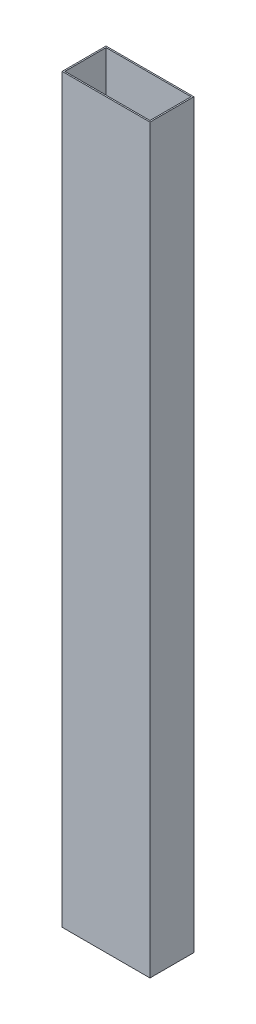
from build123d import *

# Parameters (mm, degrees)
SKETCH1_W           = 50.8
SKETCH1_H           = 25.4
BOSS_EXTRUDE1_DEPTH = 762
SKETCH2_W           = 49.1998
SKETCH2_H           = 23.7998
CUT_EXTRUDE1_DEPTH  = 763.528983056
SKETCH3_W           = 50.8
SKETCH3_H           = 25.4
CUT_EXTRUDE2_DEPTH  = 333.375


with BuildPart() as part:
    # Sketch1 → Boss-Extrude1 (new body)
    with BuildSketch(Plane(origin=(0, 0, 0), x_dir=(1, 0, 0), z_dir=(0, 1, 0))):
        Rectangle(SKETCH1_W, SKETCH1_H)
    extrude(amount=BOSS_EXTRUDE1_DEPTH)

    # Sketch2 → Cut-Extrude1 (cut, through all)
    with BuildSketch(Plane.XZ):
        Rectangle(SKETCH2_W, SKETCH2_H)
    extrude(amount=-CUT_EXTRUDE1_DEPTH, mode=Mode.SUBTRACT)

    # Sketch3 → Cut-Extrude2 (cut)
    with BuildSketch(Plane(origin=(0, 762, 0), x_dir=(1, 0, 0), z_dir=(0, 1, 0))):
        Rectangle(SKETCH3_W, SKETCH3_H)
    extrude(amount=-CUT_EXTRUDE2_DEPTH, mode=Mode.SUBTRACT)


solid = part.part
